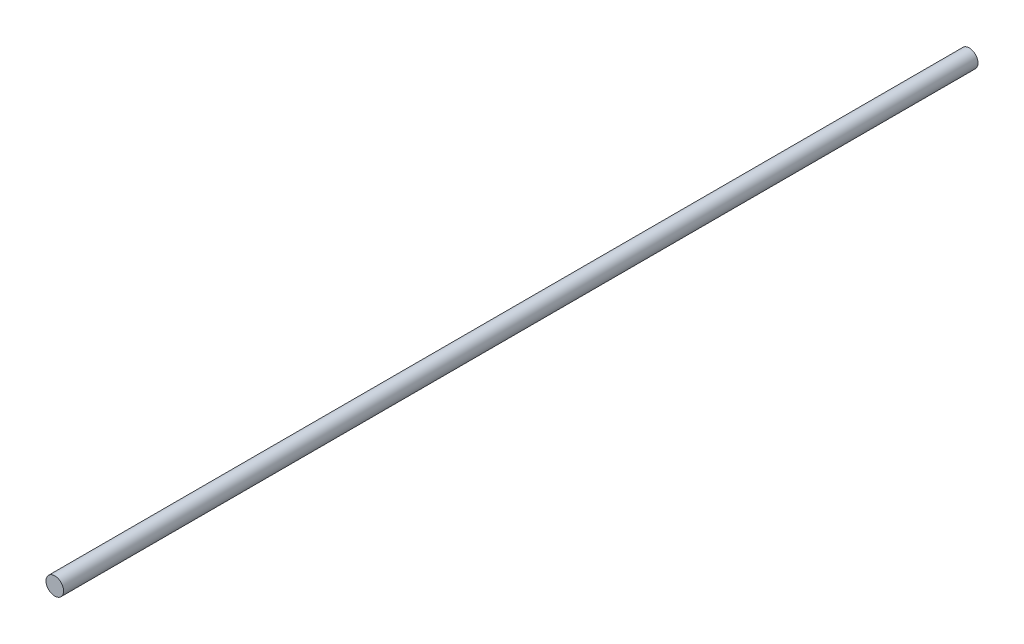
from build123d import *

# Parameters (mm, degrees)
SKETCH1_R           = 6.35
BOSS_EXTRUDE1_DEPTH = 660.4


with BuildPart() as part:
    # Sketch1 → Boss-Extrude1 (new body)
    with BuildSketch(Plane.XY):
        with Locations(Location((-177.8, -95.25, 0), (0, 0, 180))):
            Circle(SKETCH1_R)
    extrude(amount=BOSS_EXTRUDE1_DEPTH)


solid = part.part
